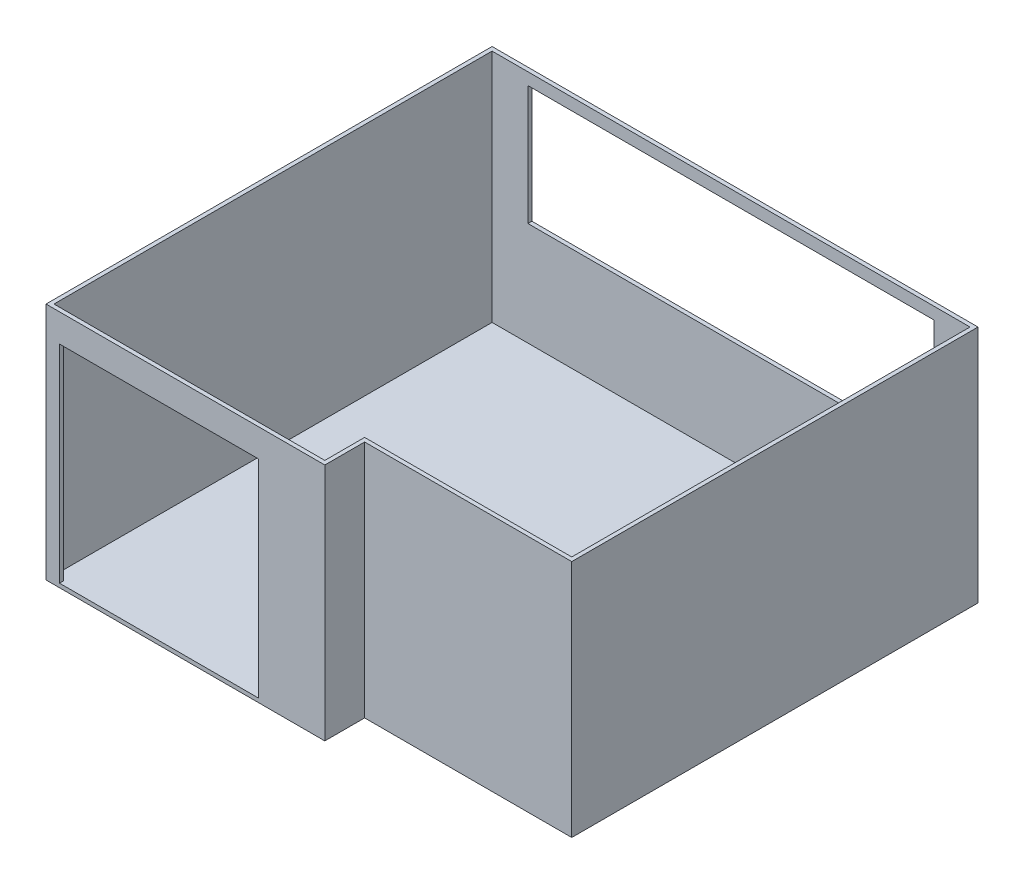
from build123d import *

# Parameters (mm, degrees)
BOSS_EXTRUDE1_DEPTH = 3000
SHELL2_T            = -50
SKETCH2_W           = 2500
SKETCH2_H           = 2600
CUT_EXTRUDE1_DEPTH  = 3000
SKETCH3_W           = 5100
SKETCH3_H           = 1500
CUT_EXTRUDE2_DEPTH  = 3000


with BuildPart() as part:
    # Sketch1 → Boss-Extrude1 (new body)
    with BuildSketch(Plane(origin=(0, 0, 0), x_dir=(1, 0, 0), z_dir=(0, 1, 0))):
        Polygon((450, -2800), (-3050, -2800), (-3050, 2800), (3050, 2800), (3050, -2300), (450, -2300), align=None)
    extrude(amount=BOSS_EXTRUDE1_DEPTH)

    # Shell2
    shell2_openings = [part.faces().sort_by_distance(p)[0] for p in [
        (-69.233110164, 3000, -100.882531954),
    ]]
    offset(amount=SHELL2_T, openings=shell2_openings, kind=Kind.INTERSECTION)

    # Sketch2 → Cut-Extrude1 (cut)
    with BuildSketch(Plane.XY.offset(2800)):
        with Locations((-1630, 1350)):
            Rectangle(SKETCH2_W, SKETCH2_H)
    extrude(amount=-CUT_EXTRUDE1_DEPTH, mode=Mode.SUBTRACT)

    # Sketch3 → Cut-Extrude2 (cut)
    with BuildSketch(Plane(origin=(0, 0, -2800), x_dir=(-1, 0, 0), z_dir=(0, 0, -1))):
        with Locations((0, 2100)):
            Rectangle(SKETCH3_W, SKETCH3_H)
    extrude(amount=-CUT_EXTRUDE2_DEPTH, mode=Mode.SUBTRACT)


solid = part.part
